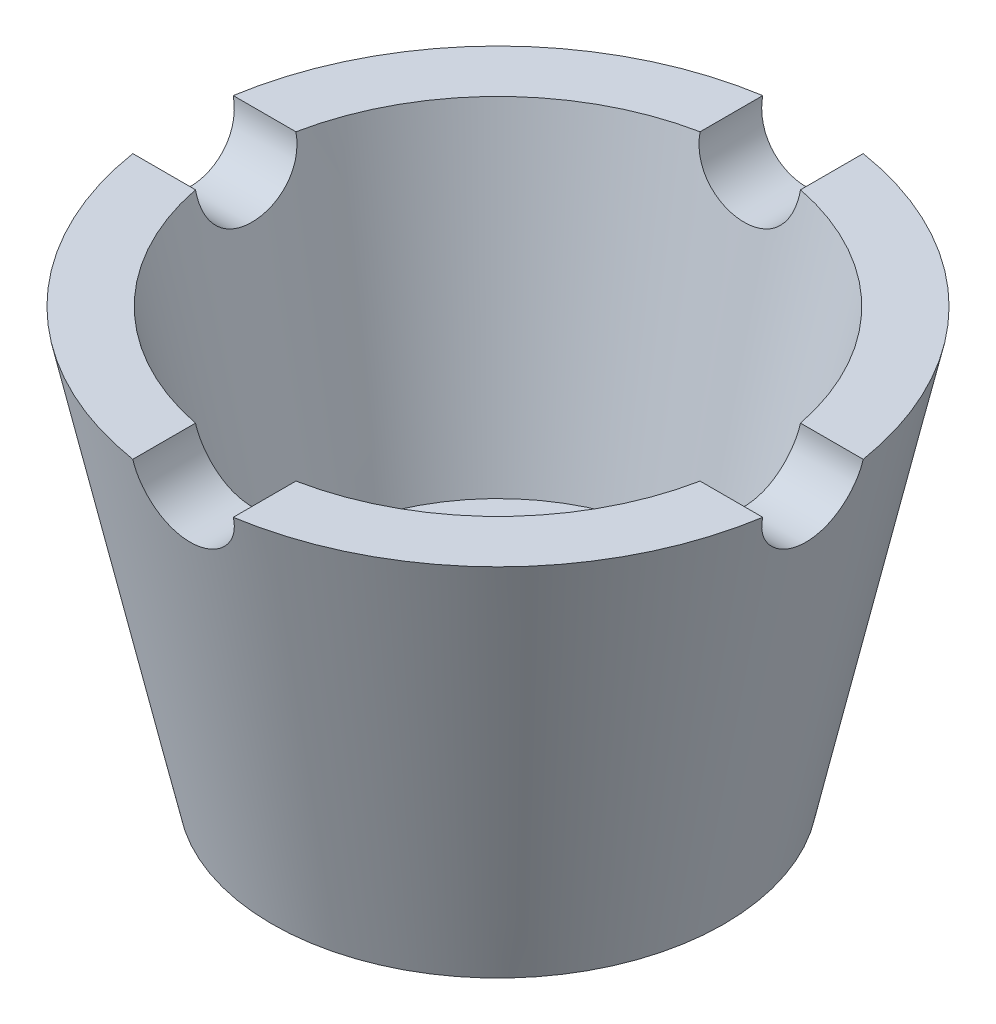
from build123d import *

# Parameters (mm, degrees)
SKETCH2_R          = 5
CUT_EXTRUDE1_DEPTH = 50
CIRPATTERN1_COUNT  = 4


with BuildPart() as part:
    # Sketch1 → Revolve1 (revolve)
    with BuildSketch(Plane.XY, mode=Mode.PRIVATE) as revolve1_sk:
        Polygon((11, 0), (11, 12), (19, 12), (25.609760166, 42), (31.753664233, 42), (22.5, 0), align=None)
    revolve(revolve1_sk.sketch.rotate(Axis((0, 0, 0), (0, 1, 0)), 90), axis=Axis((0, 0, 0), (0, 1, 0)))

    # Sketch2 → Cut-Extrude1 (cut)
    with BuildSketch(Plane.XY):
        with Locations((0, 42)):
            Circle(SKETCH2_R)
    cut_extrude1 = extrude(amount=-CUT_EXTRUDE1_DEPTH, mode=Mode.SUBTRACT)

    # CirPattern1: Cut-Extrude1 ×4 about axis
    cirpattern1_axis = Axis((0, 0, 0), (0, 1, 0))
    for i in range(1, CIRPATTERN1_COUNT):
        add(cut_extrude1.rotate(cirpattern1_axis, i * 360 / CIRPATTERN1_COUNT), mode=Mode.SUBTRACT)


solid = part.part
